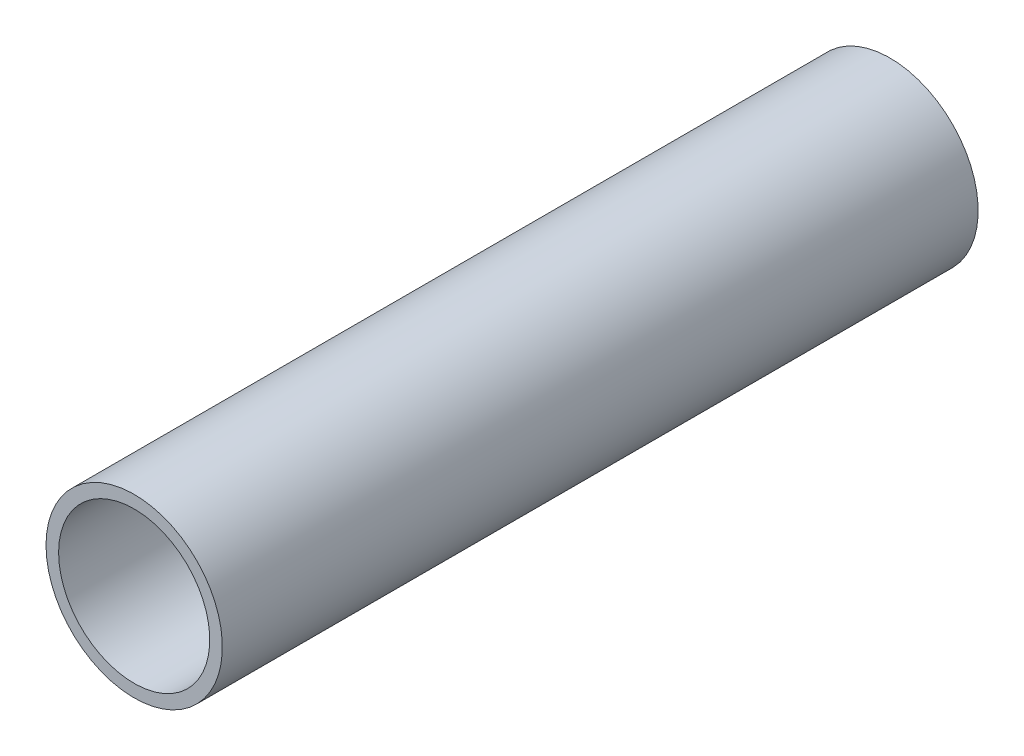
from build123d import *

# Parameters (mm, degrees)
ESQUISSE1_R        = 7
ESQUISSE1_R_2      = 6
BOSS_EXTRU_1_DEPTH = 60


with BuildPart() as part:
    # Esquisse1 → Boss.-Extru.1 (new body)
    with BuildSketch(Plane.XY):
        with Locations(Location((0, 0, 0), (0, 0, 180))):
            Circle(ESQUISSE1_R)
        with Locations(Location((0, 0, 0), (0, 0, 180))):
            Circle(ESQUISSE1_R_2, mode=Mode.SUBTRACT)
    extrude(amount=BOSS_EXTRU_1_DEPTH)


solid = part.part
